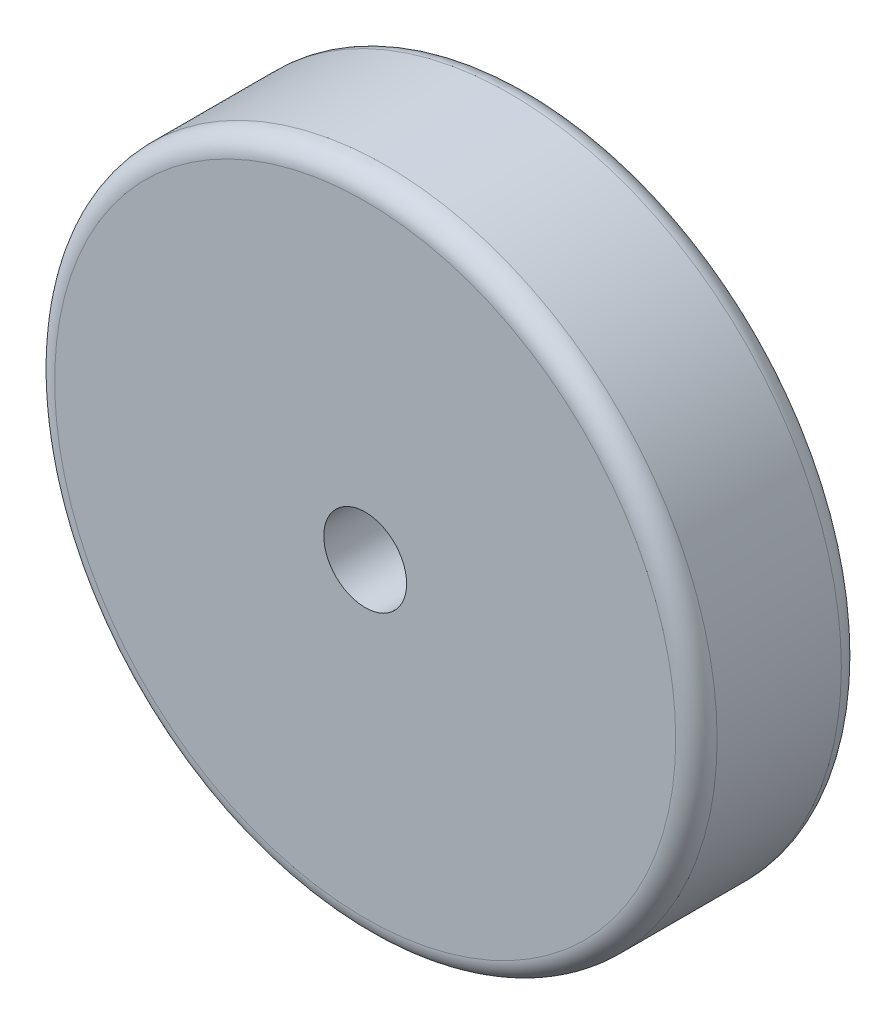
from build123d import *

# Parameters (mm, degrees)
SKETCH2_R           = 4
SKETCH2_R_2         = 0.5
BOSS_EXTRUDE1_DEPTH = 2
FILLET1_R           = 0.25


with BuildPart() as part:
    # Sketch2 → Boss-Extrude1 (new body)
    with BuildSketch(Plane.XY):
        Circle(SKETCH2_R)
        Circle(SKETCH2_R_2, mode=Mode.SUBTRACT)
    extrude(amount=BOSS_EXTRUDE1_DEPTH)

    # Fillet1
    fillet1_edges = [part.edges().sort_by_distance(p)[0] for p in [
        (-4, 0, 0),
        (-4, 0, 2),
    ]]
    fillet(fillet1_edges, radius=FILLET1_R)


solid = part.part
